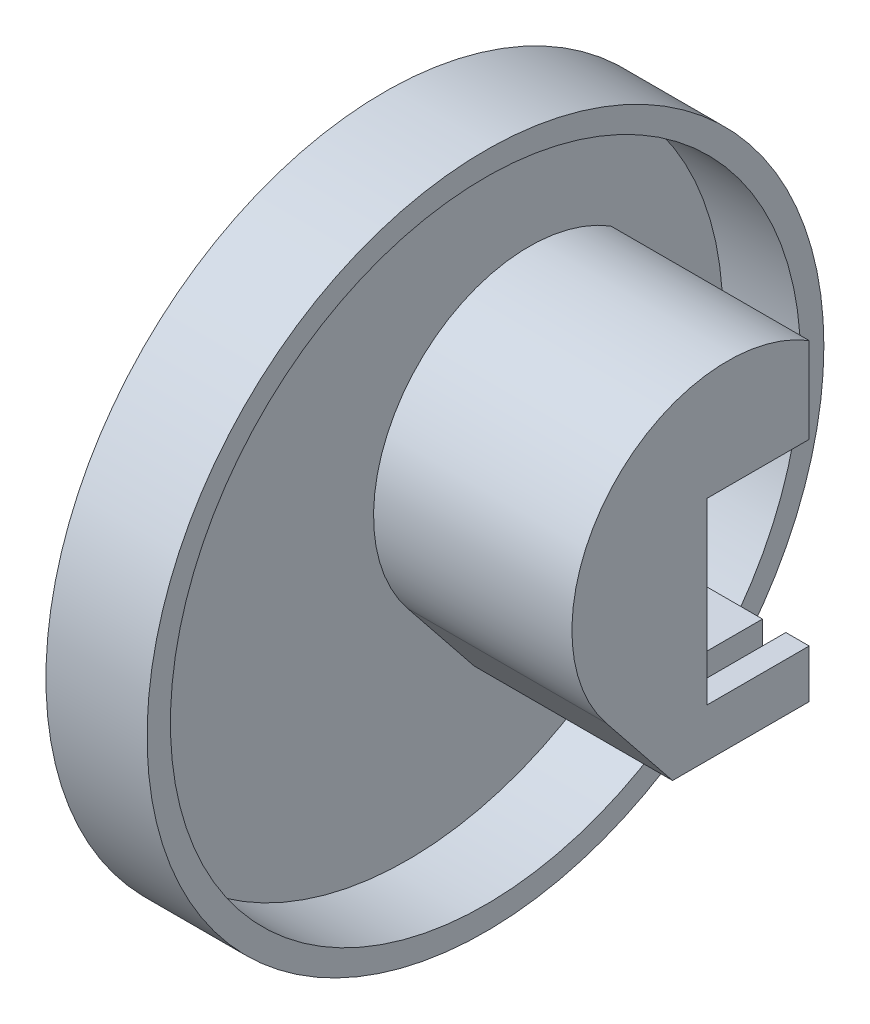
from build123d import *

# Parameters (mm, degrees)
ESQUISSE2_R        = 43.50000000000001
ESQUISSE2_R_2      = 40.5
BOSS_EXTRU_1_DEPTH = 10
BOSS_EXTRU_2_START = -3
ESQUISSE2_2_R      = 43.50000000000001
BOSS_EXTRU_2_DEPTH = 3
BOSS_EXTRU_3_DEPTH = 12
BOSS_EXTRU_4_START = 12
BOSS_EXTRU_4_DEPTH = 7.5
BOSS_EXTRU_5_START = 19.5
BOSS_EXTRU_5_DEPTH = 3
BOSS_EXTRU_6_START = 22.5
BOSS_EXTRU_6_DEPTH = 3


with BuildPart() as part:
    # Esquisse2 → Boss.-Extru.1 (new body)
    with BuildSketch(Plane(origin=(0, 0, 0), x_dir=(0, 0, -1), z_dir=(1, 0, 0))):
        Circle(ESQUISSE2_R)
        Circle(ESQUISSE2_R_2, mode=Mode.SUBTRACT)
    extrude(amount=BOSS_EXTRU_1_DEPTH)

    # Esquisse2<2> → Boss.-Extru.2 (add)
    with BuildSketch(Plane(origin=(0, 0, 0), x_dir=(0, 0, -1), z_dir=(1, 0, 0)).offset(BOSS_EXTRU_2_START)):
        Circle(ESQUISSE2_2_R)
    extrude(amount=BOSS_EXTRU_2_DEPTH)

    # Esquisse3 → Boss.-Extru.3 (add)
    with BuildSketch(Plane(origin=(0, 0, 0), x_dir=(0, 0, -1), z_dir=(1, 0, 0))):
        with BuildLine():
            Line((26.11118120318316, 15.522854869939358), (26.11118120318316, 17.022854869939355))
            ThreePointArc((26.111181203183165, 17.02285486993936), (12.199019622456863, 19.70655185145899), (3.55e-15, 12.500000000000004))
            ThreePointArc((3.55e-15, 12.500000000000002), (-4.387505004004, 4.4e-16), (5.33e-15, -12.5))
            Line((3.55e-15, -12.5), (8.54855768792795, -23.17714513006065))
            Line((8.54855768792795, -23.17714513006065), (13.000000000000005, -23.17714513006065))
            Line((13.000000000000005, -23.177145130060648), (13.000000000000004, -16.97714513006065))
            Line((13.000000000000004, -16.97714513006065), (13.000000000000004, -15.677145130060648))
            ThreePointArc((13.000000000000004, -15.677145130060646), (3.4519983220891106, 6.690070139129679), (26.111181203183158, 15.522854869939358))
        make_face()
    extrude(amount=BOSS_EXTRU_3_DEPTH)

    # Esquisse3<3> → Boss.-Extru.4 (add)
    with BuildSketch(Plane(origin=(0, 0, 0), x_dir=(0, 0, -1), z_dir=(1, 0, 0)).offset(BOSS_EXTRU_4_START)):
        with BuildLine():
            Line((26.11118120318316, 17.022854869939355), (26.11118120318316, 6.022854869939354))
            Line((26.11118120318316, 6.022854869939354), (13, 6.022854869939352))
            Line((13, 6.022854869939352), (13.000000000000004, -16.97714513006065))
            Line((13.000000000000004, -16.97714513006065), (26.111181203183165, -16.97714513006065))
            Line((26.111181203183165, -16.97714513006065), (26.11118120318317, -23.177145130060648))
            Line((26.11118120318317, -23.177145130060648), (8.54855768792795, -23.17714513006065))
            Line((8.54855768792795, -23.17714513006065), (3.37e-15, -12.5))
            ThreePointArc((3.37e-15, -12.5), (-4.387505004004002, -2.45e-15), (3.37e-15, 12.5))
            ThreePointArc((3.37e-15, 12.5), (12.199019622456856, 19.70655185145899), (26.11118120318316, 17.022854869939355))
        make_face()
    extrude(amount=BOSS_EXTRU_4_DEPTH)

    # Esquisse3<4> → Boss.-Extru.5 (add)
    with BuildSketch(Plane(origin=(0, 0, 0), x_dir=(0, 0, -1), z_dir=(1, 0, 0)).offset(BOSS_EXTRU_5_START)):
        with BuildLine():
            Line((26.11118120318316, 11.322854869939354), (26.11118120318316, 15.522854869939358))
            ThreePointArc((26.111181203183158, 15.522854869939358), (3.4519983220891106, 6.690070139129679), (13.000000000000004, -15.677145130060646))
            Line((13.000000000000004, -15.677145130060648), (13, 6.022854869939352))
            Line((13, 6.022854869939352), (13, 11.322854869939354))
            Line((13, 11.322854869939354), (26.11118120318316, 11.322854869939354))
        make_face()
        with BuildLine():
            Line((26.11118120318316, 15.522854869939358), (26.11118120318316, 17.022854869939355))
            ThreePointArc((26.111181203183165, 17.02285486993936), (12.199019622456863, 19.70655185145899), (3.55e-15, 12.500000000000004))
            ThreePointArc((3.55e-15, 12.500000000000002), (-4.387505004004, 4.4e-16), (5.33e-15, -12.5))
            Line((3.55e-15, -12.5), (8.54855768792795, -23.17714513006065))
            Line((8.54855768792795, -23.17714513006065), (13.000000000000005, -23.17714513006065))
            Line((13.000000000000005, -23.177145130060648), (13.000000000000004, -16.97714513006065))
            Line((13.000000000000004, -16.97714513006065), (13.000000000000004, -15.677145130060648))
            ThreePointArc((13.000000000000004, -15.677145130060646), (3.4519983220891106, 6.690070139129679), (26.111181203183158, 15.522854869939358))
        make_face()
    extrude(amount=BOSS_EXTRU_5_DEPTH)

    # Esquisse3<5> → Boss.-Extru.6 (add)
    with BuildSketch(Plane(origin=(0, 0, 0), x_dir=(0, 0, -1), z_dir=(1, 0, 0)).offset(BOSS_EXTRU_6_START)):
        Polygon((26.111181203183165, -16.97714513006065), (13.000000000000004, -16.97714513006065), (13.000000000000005, -23.177145130060648), (26.11118120318317, -23.177145130060648), align=None)
        with BuildLine():
            Line((26.11118120318316, 15.522854869939358), (26.11118120318316, 17.022854869939355))
            ThreePointArc((26.111181203183165, 17.02285486993936), (12.199019622456863, 19.70655185145899), (3.55e-15, 12.500000000000004))
            ThreePointArc((3.55e-15, 12.500000000000002), (-4.387505004004, 4.4e-16), (5.33e-15, -12.5))
            Line((3.55e-15, -12.5), (8.54855768792795, -23.17714513006065))
            Line((8.54855768792795, -23.17714513006065), (13.000000000000005, -23.17714513006065))
            Line((13.000000000000005, -23.177145130060648), (13.000000000000004, -16.97714513006065))
            Line((13.000000000000004, -16.97714513006065), (13.000000000000004, -15.677145130060648))
            ThreePointArc((13.000000000000004, -15.677145130060646), (3.4519983220891106, 6.690070139129679), (26.111181203183158, 15.522854869939358))
        make_face()
        with BuildLine():
            Line((26.11118120318316, 11.322854869939354), (26.11118120318316, 15.522854869939358))
            ThreePointArc((26.111181203183158, 15.522854869939358), (3.4519983220891106, 6.690070139129679), (13.000000000000004, -15.677145130060646))
            Line((13.000000000000004, -15.677145130060648), (13, 6.022854869939352))
            Line((13, 6.022854869939352), (13, 11.322854869939354))
            Line((13, 11.322854869939354), (26.11118120318316, 11.322854869939354))
        make_face()
        Polygon((26.11118120318316, 6.022854869939355), (26.11118120318316, 11.322854869939354), (13, 11.322854869939354), (13, 6.022854869939352), align=None)
    extrude(amount=BOSS_EXTRU_6_DEPTH)


solid = part.part
